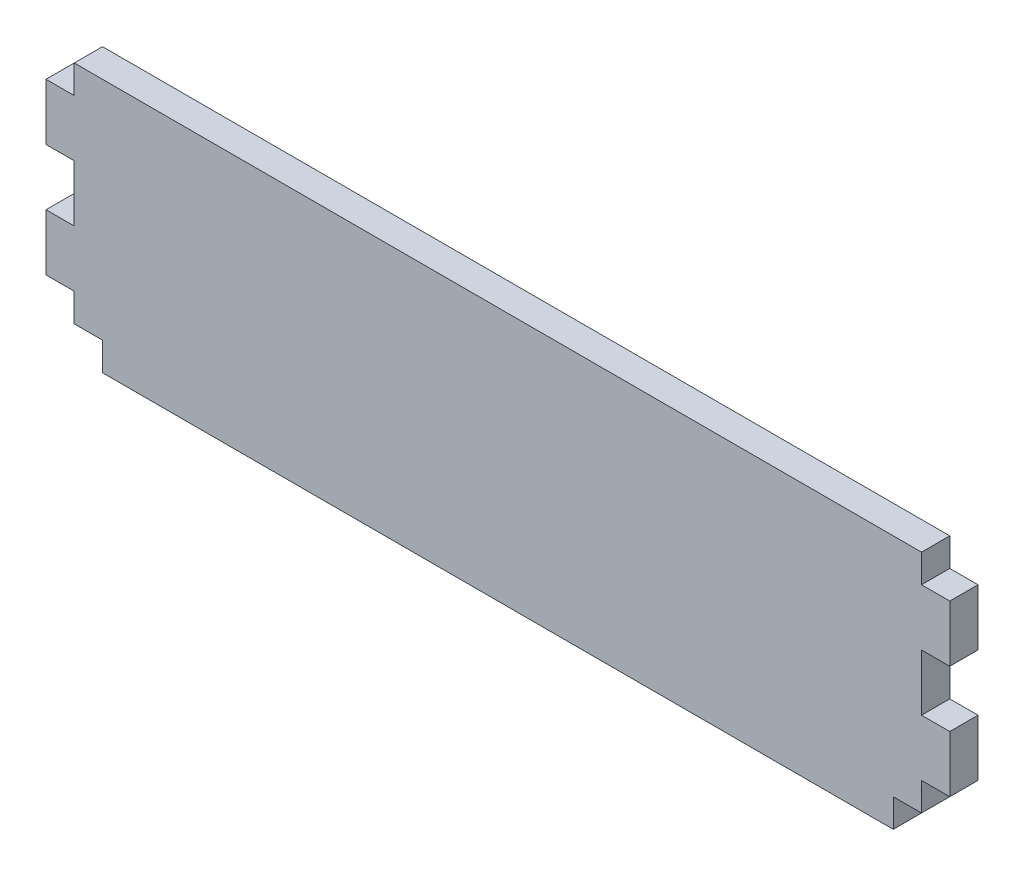
from build123d import *

# Parameters (mm, degrees)
BOSS_EXTRU_1_DEPTH = 5
ESQUISSE2_W        = 140
ESQUISSE2_H        = 5
BOSS_EXTRU_2_DEPTH = 5


with BuildPart() as part:
    # Esquisse1 → Boss.-Extru.1 (new body)
    with BuildSketch(Plane.XY):
        Polygon((85.505013729, -34.223744292), (85.505013729, -29.223744292), (-64.494986271, -29.223744292), (-64.494986271, -34.223744292), (-69.494986271, -34.223744292), (-69.494986271, -44.223744292), (-64.494986271, -44.223744292), (-64.494986271, -54.223744292), (-69.494986271, -54.223744292), (-69.494986271, -64.223744292), (-64.494986271, -64.223744292), (-64.494986271, -69.223744292), (85.505013729, -69.223744292), (85.505013729, -64.223744292), (90.505013729, -64.223744292), (90.505013729, -54.223744292), (85.505013729, -54.223744292), (85.505013729, -44.223744292), (90.505013729, -44.223744292), (90.505013729, -34.223744292), align=None)
    extrude(amount=BOSS_EXTRU_1_DEPTH)

    # Esquisse2 → Boss.-Extru.2 (add)
    with BuildSketch(Plane.XY.offset(5)):
        with Locations((10.505013729, -71.723744292)):
            Rectangle(ESQUISSE2_W, ESQUISSE2_H)
    extrude(amount=-BOSS_EXTRU_2_DEPTH)


solid = part.part
